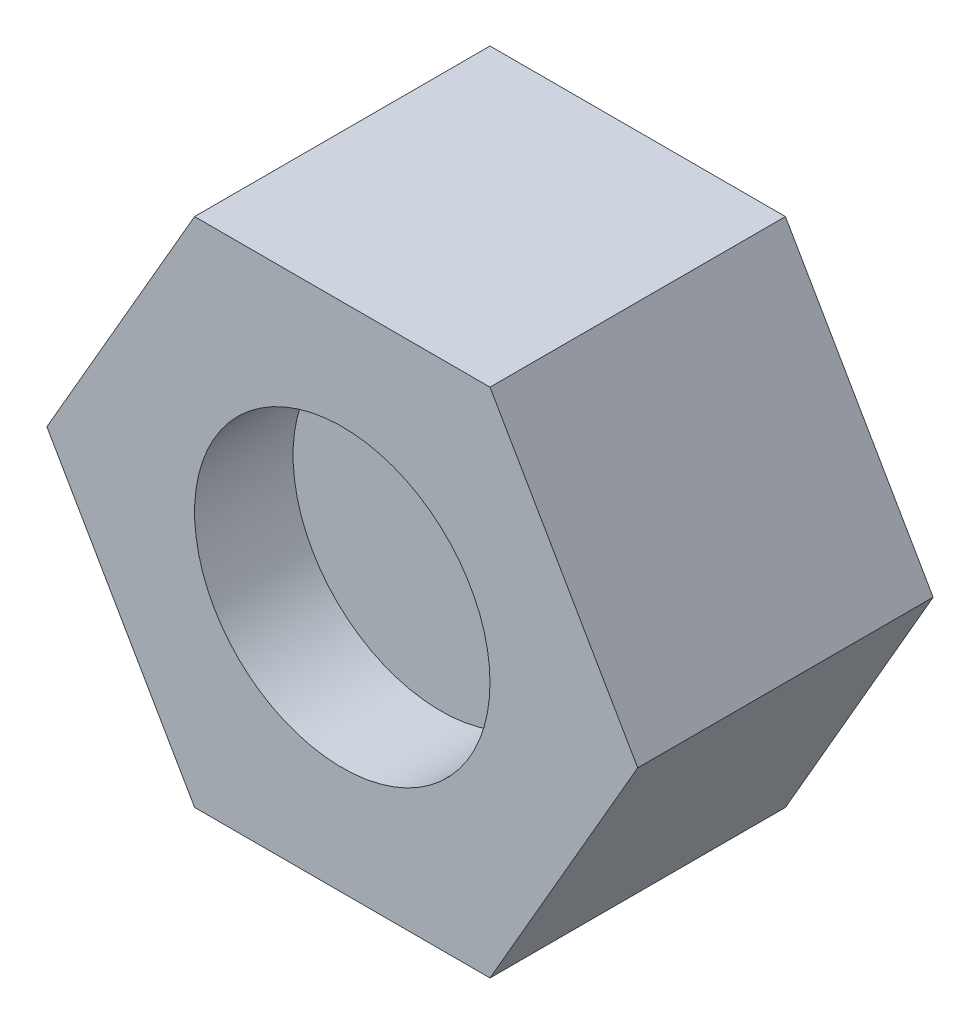
from build123d import *

# Parameters (mm, degrees)
BOSS_EXTRUDE1_DEPTH = 15
SKETCH2_R           = 7.5
CUT_EXTRUDE1_DEPTH  = 5


with BuildPart() as part:
    # Sketch1 → Boss-Extrude1 (new body)
    with BuildSketch(Plane.XY):
        Polygon((7.5, -12.990381057), (15, 0), (7.5, 12.990381057), (-7.5, 12.990381057), (-15, 0), (-7.5, -12.990381057), align=None)
    extrude(amount=BOSS_EXTRUDE1_DEPTH)

    # Sketch2 → Cut-Extrude1 (cut)
    with BuildSketch(Plane.XY.offset(15)):
        Circle(SKETCH2_R)
    extrude(amount=-CUT_EXTRUDE1_DEPTH, mode=Mode.SUBTRACT)


solid = part.part
